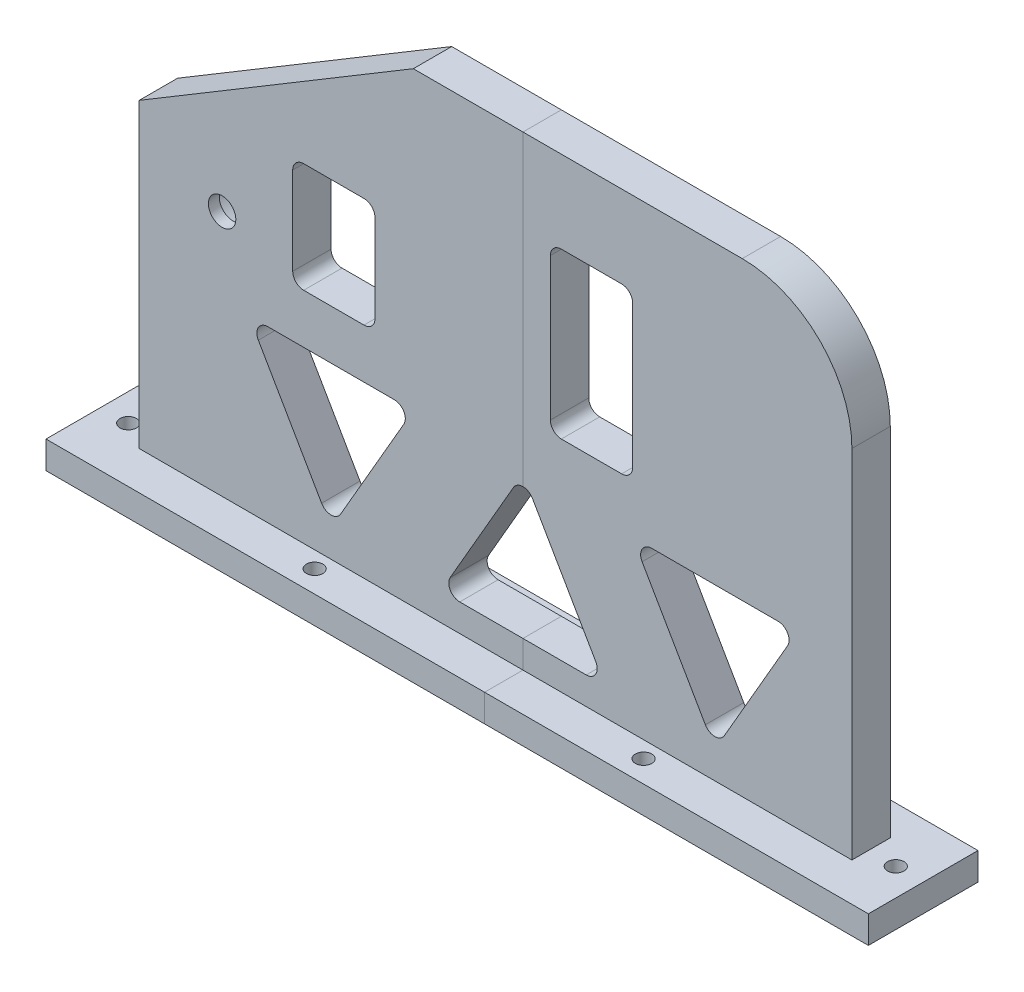
from build123d import *

# Parameters (mm, degrees)
SKETCH_3_W              = 130
SKETCH_3_H              = 90
EXTRUDE_2_DEPTH         = 7
HOLE_WIZARD_14_0_14_1_D = 5
CUT_EXTRUDE_START       = -2
SKETCH_22_R             = 7
CUT_EXTRUDE_4_DEPTH     = 5
CHAMFER_2_SIZE          = 50
CHAMFER_2_SIZE2         = 30
FILLET_3_R              = 20
SKETCH_25_W             = 150
SKETCH_25_H             = 20
EXTRUDE_3_DEPTH         = 5
SKETCH_26_R             = 1.5
CUT_EXTRUDE_5_DEPTH     = 165.380655796
CUT_EXTRUDE_6_REACH     = 168.94
FILLET_4_R              = 2
SKETCH_28_W             = 15
SKETCH_28_H             = 30
SKETCH_28_H_2           = 20
CUT_EXTRUDE_7_DEPTH     = 168.020956769
FILLET_5_R              = 2


with BuildPart() as part:
    # 草图3 → 凸台-拉伸2 (new body)
    with BuildSketch(Plane.XY):
        with Locations((65, 45)):
            Rectangle(SKETCH_3_W, SKETCH_3_H)
    extrude(amount=EXTRUDE_2_DEPTH)

    # Ø14.0 (14) 直径孔1 (through all)
    with Locations(Plane(origin=(0, 0, 0), x_dir=(-1, 0, 0), z_dir=(0, 0, -1))):
        with Locations((-15.120799087, 50)):
            Hole(HOLE_WIZARD_14_0_14_1_D / 2)

    # 草图22 → 切除-拉伸4 (cut)
    with BuildSketch(Plane.XY.offset(7).offset(CUT_EXTRUDE_START)):
        with Locations((15.120799087, 50)):
            Circle(SKETCH_22_R)
        with Locations((55.912955196, 60)):
            Circle(SKETCH_22_R)
        with Locations((107.451775516, 70)):
            Circle(SKETCH_22_R)
    extrude(amount=-CUT_EXTRUDE_4_DEPTH, mode=Mode.SUBTRACT)

    # 倒角2
    chamfer_2_edges = [part.edges().sort_by_distance(p)[0] for p in [
        (0, 90, 3.5),
    ]]
    chamfer_2_side = [part.faces().sort_by_distance(p)[0] for p in [
        (65, 90, 3.5),
    ]]
    chamfer(chamfer_2_edges, length=CHAMFER_2_SIZE, length2=CHAMFER_2_SIZE2, reference=chamfer_2_side[0])

    # 圆角3
    fillet_3_edges = [part.edges().sort_by_distance(p)[0] for p in [
        (130, 90, 3.5),
    ]]
    fillet(fillet_3_edges, radius=FILLET_3_R)

    # 草图25 → 凸台-拉伸3 (add)
    with BuildSketch(Plane.XZ):
        with Locations((65, 4)):
            Rectangle(SKETCH_25_W, SKETCH_25_H)
    extrude(amount=-EXTRUDE_3_DEPTH)

    # 草图26 → 切除-拉伸5 (cut, through all)
    with BuildSketch(Plane(origin=(0, 5, 0), x_dir=(1, 0, 0), z_dir=(0, 1, 0))):
        with Locations(Location((-5, -4, 0), (0, 0, 180))):
            Circle(SKETCH_26_R)
        with Locations(Location((135, -4, 0), (0, 0, 180))):
            Circle(SKETCH_26_R)
        with Locations(Location((35, 3, 0), (0, 0, 180))):
            Circle(SKETCH_26_R)
        with Locations(Location((95, 3, 0), (0, 0, 180))):
            Circle(SKETCH_26_R)
        with Locations(Location((35, -10, 0), (0, 0, 180))):
            Circle(SKETCH_26_R)
        with Locations(Location((95, -10, 0), (0, 0, 180))):
            Circle(SKETCH_26_R)
    extrude(amount=-CUT_EXTRUDE_5_DEPTH, mode=Mode.SUBTRACT)

    # 草图27 → 切除-拉伸6 (cut, up to next)
    with BuildSketch(Plane.XY.offset(7), mode=Mode.PRIVATE) as cut_extrude_6_sk1:
        Polygon((55, 10), (85, 10), (70, 35.980762114), align=None)
    cut_extrude_6_tool1 = extrude(cut_extrude_6_sk1.sketch, amount=-CUT_EXTRUDE_6_REACH, mode=Mode.PRIVATE) & part.part
    # 草图27 → 切除-拉伸6 (cut, up to next)
    with BuildSketch(Plane.XY.offset(7), mode=Mode.PRIVATE) as cut_extrude_6_sk2:
        Polygon((20, 35.980762114), (50, 35.980762114), (35, 10), align=None)
    cut_extrude_6_tool2 = extrude(cut_extrude_6_sk2.sketch, amount=-CUT_EXTRUDE_6_REACH, mode=Mode.PRIVATE) & part.part
    # 草图27 → 切除-拉伸6 (cut, up to next)
    with BuildSketch(Plane.XY.offset(7), mode=Mode.PRIVATE) as cut_extrude_6_sk3:
        Polygon((90, 35.980762114), (120, 35.980762114), (105, 10), align=None)
    cut_extrude_6_tool3 = extrude(cut_extrude_6_sk3.sketch, amount=-CUT_EXTRUDE_6_REACH, mode=Mode.PRIVATE) & part.part
    add(cut_extrude_6_tool1.solids().sort_by_distance((70, 18.660254, 7))[0], mode=Mode.SUBTRACT)
    add(cut_extrude_6_tool2.solids().sort_by_distance((35, 27.320508, 7))[0], mode=Mode.SUBTRACT)
    add(cut_extrude_6_tool3.solids().sort_by_distance((105, 27.320508, 7))[0], mode=Mode.SUBTRACT)

    # 圆角4
    fillet_4_edges = [part.edges().sort_by_distance(p)[0] for p in [
        (35, 10, 3.5),
        (20, 35.980762114, 3.5),
        (50, 35.980762114, 3.5),
        (105, 10, 3.5),
        (90, 35.980762114, 3.5),
        (120, 35.980762114, 3.5),
        (55, 10, 3.5),
        (70, 35.980762114, 3.5),
        (85, 10, 3.5),
    ]]
    fillet(fillet_4_edges, radius=FILLET_4_R)

    # 草图28 → 切除-拉伸7 (cut, through all)
    with BuildSketch(Plane(origin=(0, 0, 0), x_dir=(-1, 0, 0), z_dir=(0, 0, -1))):
        with Locations((-82.5, 60)):
            Rectangle(SKETCH_28_W, SKETCH_28_H)
        with Locations((-35.5, 55)):
            Rectangle(SKETCH_28_W, SKETCH_28_H_2)
    extrude(amount=-CUT_EXTRUDE_7_DEPTH, mode=Mode.SUBTRACT)

    # 圆角5
    fillet_5_edges = [part.edges().sort_by_distance(p)[0] for p in [
        (90, 45, 3.5),
        (90, 75, 3.5),
        (75, 75, 3.5),
        (75, 45, 3.5),
        (43, 45, 3.5),
        (43, 65, 3.5),
        (28, 65, 3.5),
        (28, 45, 3.5),
    ]]
    fillet(fillet_5_edges, radius=FILLET_5_R)


with BuildPart() as body_2:
    # Split Bodies 1: the piece on the far side of the plane
    add(part.part)
    split(bisect_by=Plane(origin=(70, 0, 0), x_dir=(0, -1, 0), z_dir=(-1, 0, 0)), keep=Keep.BOTTOM)


with BuildPart() as part_1:
    add(part.part)

    # Split Bodies 1
    split(bisect_by=Plane(origin=(70, 0, 0), x_dir=(0, -1, 0), z_dir=(-1, 0, 0)), keep=Keep.TOP)


solid = Compound([body_2.part, part_1.part])
